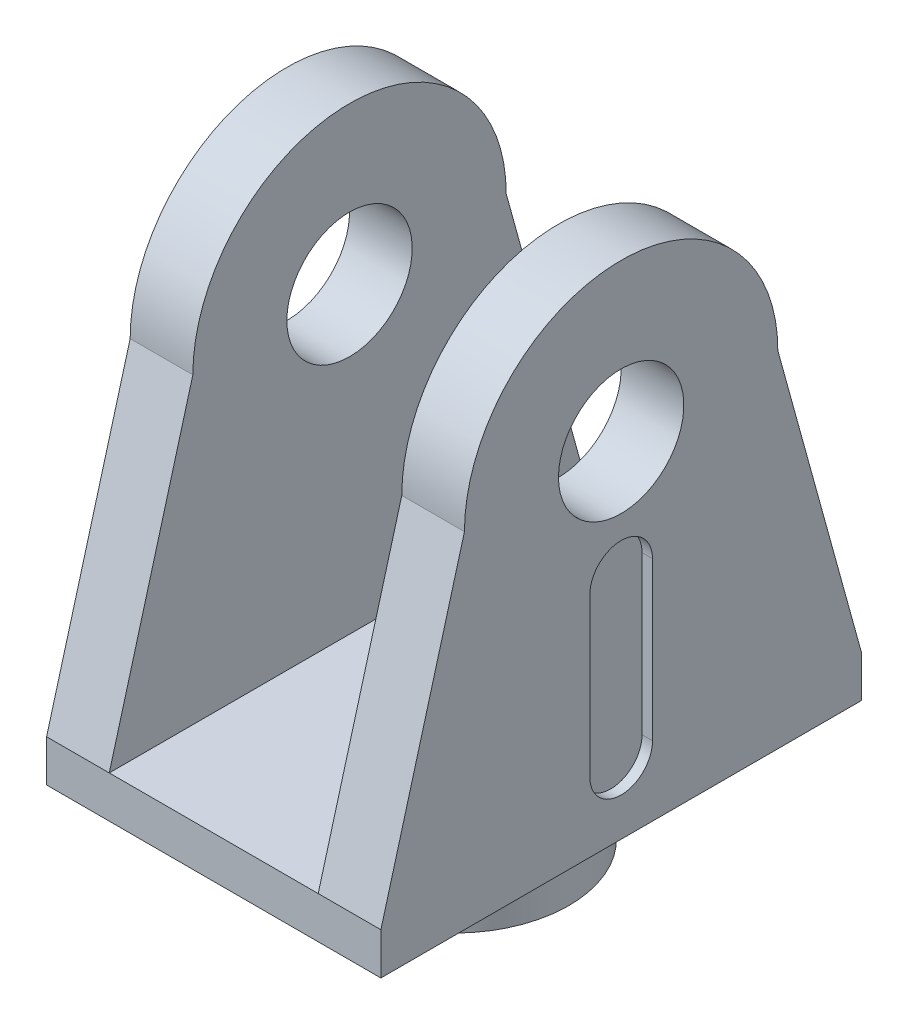
from build123d import *

# Parameters (mm, degrees)
BOSS_EXTRUDE1_DEPTH = 115
SKETCH3_R           = 55
BOSS_EXTRUDE2_DEPTH = 40
CUT_EXTRUDE2_REACH  = 312.524
SKETCH2_R           = 30
CUT_EXTRUDE3_DEPTH  = 5


with BuildPart() as part:
    # Sketch1 → Boss-Extrude1 (new, symmetric)
    with BuildSketch(Plane.XY):
        Polygon((80, 0), (-80, 0), (-80, 240), (-50, 240), (-50, 20), (50, 20), (50, 240), (80, 240), align=None)
    extrude(amount=BOSS_EXTRUDE1_DEPTH, both=True)

    # Sketch3 → Boss-Extrude2 (add)
    with BuildSketch(Plane.XZ):
        with Locations(Location((0, 0, 0), (0, 0, 270))):
            Circle(SKETCH3_R)
    extrude(amount=BOSS_EXTRUDE2_DEPTH)

    # Cut-Extrude2: up to this face of the body (flat: up to its plane)
    cut_extrude2_end = Plane(part.part.faces().sort_by_distance((80, 120, 0))[0])
    # Sketch2 → Cut-Extrude2 (cut, up to the picked face)
    with BuildSketch(Plane.ZY.offset(80), mode=Mode.PRIVATE) as cut_extrude2_sk1:
        with BuildLine():
            ThreePointArc((-75, 165), (-53.033008792, 218.033008386), (-5.74e-07, 240))
            Line((-5.74e-07, 240), (-115, 240))
            Line((-115, 240), (-115, 20))
            Line((-115, 20), (-75, 165))
        make_face()
    cut_extrude2_tool1 = split(extrude(cut_extrude2_sk1.sketch, amount=-CUT_EXTRUDE2_REACH, mode=Mode.PRIVATE), bisect_by=cut_extrude2_end, keep=Keep.BOTH, mode=Mode.PRIVATE)
    # Sketch2 → Cut-Extrude2 (cut, up to the picked face)
    with BuildSketch(Plane.ZY.offset(80), mode=Mode.PRIVATE) as cut_extrude2_sk2:
        with BuildLine():
            ThreePointArc((-5.74e-07, 240), (53.033008386, 218.033008792), (75, 165))
            Line((75, 165), (115, 20))
            Line((115, 20), (115, 240))
            Line((115, 240), (-5.74e-07, 240))
        make_face()
    cut_extrude2_tool2 = split(extrude(cut_extrude2_sk2.sketch, amount=-CUT_EXTRUDE2_REACH, mode=Mode.PRIVATE), bisect_by=cut_extrude2_end, keep=Keep.BOTH, mode=Mode.PRIVATE)
    # Sketch2 → Cut-Extrude2 (cut, up to the picked face)
    with BuildSketch(Plane.ZY.offset(80), mode=Mode.PRIVATE) as cut_extrude2_sk3:
        with Locations((0, 165)):
            Circle(SKETCH2_R)
    cut_extrude2_tool3 = split(extrude(cut_extrude2_sk3.sketch, amount=-CUT_EXTRUDE2_REACH, mode=Mode.PRIVATE), bisect_by=cut_extrude2_end, keep=Keep.BOTH, mode=Mode.PRIVATE)
    add(cut_extrude2_tool1.solids().sort_by(Axis((-80, 171.000425, -91.477903), (1, 0, 0)))[0], mode=Mode.SUBTRACT)
    add(cut_extrude2_tool2.solids().sort_by(Axis((-80, 171.000425, 91.477903), (1, 0, 0)))[0], mode=Mode.SUBTRACT)
    add(cut_extrude2_tool3.solids().sort_by(Axis((-80, 165, 0), (1, 0, 0)))[0], mode=Mode.SUBTRACT)

    # Sketch4 → Cut-Extrude3 (cut)
    with BuildSketch(Plane.ZY.offset(80)):
        with BuildLine():
            Line((15, 108.832847002), (15, 33.352154436))
            ThreePointArc((15, 33.352154436), (0, 18.352154436), (-15, 33.352154436))
            Line((-15, 33.352154436), (-15, 108.832847002))
            ThreePointArc((-15, 108.832847002), (0, 123.832847002), (15, 108.832847002))
        make_face()
    cut_extrude3 = extrude(amount=-CUT_EXTRUDE3_DEPTH, mode=Mode.SUBTRACT)

    # Mirror1: Cut-Extrude3 across plane
    add(cut_extrude3.mirror(Plane(origin=(0, 0, 0), x_dir=(0, 0, 1), z_dir=(1, 0, 0))), mode=Mode.SUBTRACT)


solid = part.part
